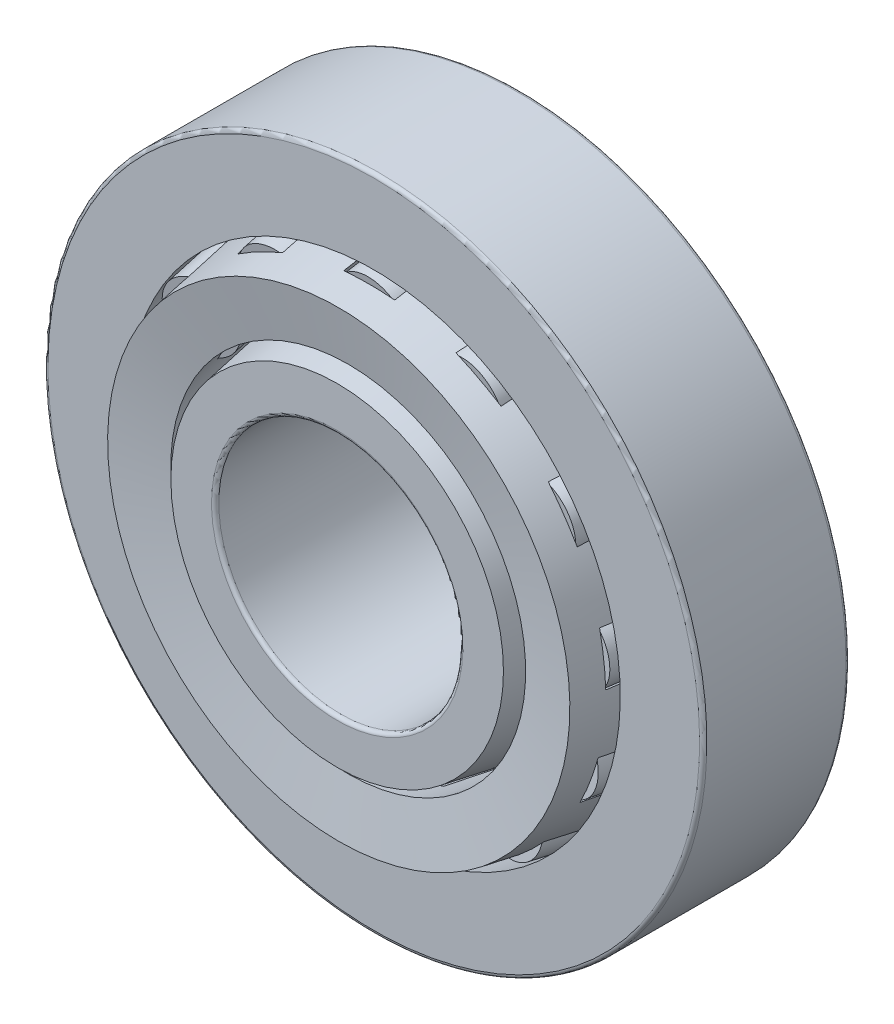
from build123d import *

# Parameters (mm, degrees)
CIRPATTERN2_COUNT = 13
CIRPATTERN1_COUNT = 13
FILLET1_R         = 0.238125
FILLET2_R         = 0.238125


with BuildPart() as part:
    # Sketch1 → Revolve1 (revolve)
    with BuildSketch(Plane(origin=(0, 0, 0), x_dir=(0, 0, -1), z_dir=(1, 0, 0))):
        Polygon((-4.7625, 21.43125), (4.7625, 21.43125), (4.7625, 17.713264491), (-4.7625, 16.03375), align=None)
    revolve(axis=Axis((0, 0, 7.14375), (0, 0, -1)))

    # Fillet1
    fillet1_edges = [part.edges().sort_by_distance(p)[0] for p in [
        (0, -21.43125, -4.7625),
        (0, -21.43125, 4.7625),
    ]]
    fillet(fillet1_edges, radius=FILLET1_R)


with BuildPart() as body_2:
    # Sketch5 → Revolve4 (revolve)
    with BuildSketch(Plane(origin=(0, 0, 0), x_dir=(0, 0, -1), z_dir=(1, 0, 0))):
        Polygon((7.14375, 13.335), (-7.14375, 10.815728263), (-7.14375, 7.9375), (7.14375, 7.9375), align=None)
    revolve(axis=Axis((0, 0, 7.14375), (0, 0, -1)))

    # Fillet2
    fillet2_edges = [body_2.edges().sort_by_distance(p)[0] for p in [
        (0, -7.9375, -7.14375),
        (0, -7.9375, 7.14375),
    ]]
    fillet(fillet2_edges, radius=FILLET2_R)


with BuildPart() as body_3:
    # Sketch2 → Revolve2 (revolve)
    with BuildSketch(Plane(origin=(0, 0, 0), x_dir=(0, 0, -1), z_dir=(1, 0, 0))):
        Polygon((-7.04118365, 15.032188703), (-6.425785552, 11.542092656), (4.7625, 13.514889266), (6.53318365, 13.827108568), (5.917785552, 17.317204615), (4.7625, 17.113496602), align=None)
    revolve(axis=Axis((0, 0, 7.14375), (0, 0, -1)))

    # Sketch3 → Cut-Revolve1 (revolve, cut)
    with BuildSketch(Plane(origin=(0, 0, 0), x_dir=(0, 0, -1), z_dir=(1, 0, 0))):
        Polygon((-4.7625, 13.634678443), (-5.172765399, 15.961409141), (4.352234601, 17.640923632), (4.7625, 15.314192934), align=None)
    cut_revolve1 = revolve(axis=Axis((0, 13.287140679, 6.733484601), (0, 0.17364817766692697, -0.9848077530122087)), mode=Mode.SUBTRACT)

    # CirPattern1: Cut-Revolve1 ×13 about axis
    cirpattern1_axis = Axis((0, 0, -7.14375), (0, 0, 1))
    for i in range(1, CIRPATTERN1_COUNT):
        add(cut_revolve1.rotate(cirpattern1_axis, i * 360 / CIRPATTERN1_COUNT), mode=Mode.SUBTRACT)


with BuildPart() as body_4:
    # Sketch4 → Revolve3 (revolve)
    with BuildSketch(Plane(origin=(0, 0, 0), x_dir=(0, 0, -1), z_dir=(1, 0, 0))):
        Polygon((-5.15071208, 15.836338556), (4.37428792, 17.515853048), (4.7625, 15.314192934), (-4.7625, 13.634678443), align=None)
    revolve(axis=Axis((0, 13.287140679, 6.733484601), (0, 0.17364817766692697, -0.9848077530122087)))


with BuildPart() as cirpattern2_1:
    # CirPattern2: pattern copy
    add(body_4.part.rotate(Axis((0, 0, -7.14375), (0, 0, 1)), 1 * 360 / CIRPATTERN2_COUNT))


with BuildPart() as cirpattern2_2:
    # CirPattern2: pattern copy
    add(body_4.part.rotate(Axis((0, 0, -7.14375), (0, 0, 1)), 2 * 360 / CIRPATTERN2_COUNT))


with BuildPart() as cirpattern2_3:
    # CirPattern2: pattern copy
    add(body_4.part.rotate(Axis((0, 0, -7.14375), (0, 0, 1)), 3 * 360 / CIRPATTERN2_COUNT))


with BuildPart() as cirpattern2_4:
    # CirPattern2: pattern copy
    add(body_4.part.rotate(Axis((0, 0, -7.14375), (0, 0, 1)), 4 * 360 / CIRPATTERN2_COUNT))


with BuildPart() as cirpattern2_5:
    # CirPattern2: pattern copy
    add(body_4.part.rotate(Axis((0, 0, -7.14375), (0, 0, 1)), 5 * 360 / CIRPATTERN2_COUNT))


with BuildPart() as cirpattern2_6:
    # CirPattern2: pattern copy
    add(body_4.part.rotate(Axis((0, 0, -7.14375), (0, 0, 1)), 6 * 360 / CIRPATTERN2_COUNT))


with BuildPart() as cirpattern2_7:
    # CirPattern2: pattern copy
    add(body_4.part.rotate(Axis((0, 0, -7.14375), (0, 0, 1)), 7 * 360 / CIRPATTERN2_COUNT))


with BuildPart() as cirpattern2_8:
    # CirPattern2: pattern copy
    add(body_4.part.rotate(Axis((0, 0, -7.14375), (0, 0, 1)), 8 * 360 / CIRPATTERN2_COUNT))


with BuildPart() as cirpattern2_9:
    # CirPattern2: pattern copy
    add(body_4.part.rotate(Axis((0, 0, -7.14375), (0, 0, 1)), 9 * 360 / CIRPATTERN2_COUNT))


with BuildPart() as cirpattern2_10:
    # CirPattern2: pattern copy
    add(body_4.part.rotate(Axis((0, 0, -7.14375), (0, 0, 1)), 10 * 360 / CIRPATTERN2_COUNT))


with BuildPart() as cirpattern2_11:
    # CirPattern2: pattern copy
    add(body_4.part.rotate(Axis((0, 0, -7.14375), (0, 0, 1)), 11 * 360 / CIRPATTERN2_COUNT))


with BuildPart() as cirpattern2_12:
    # CirPattern2: pattern copy
    add(body_4.part.rotate(Axis((0, 0, -7.14375), (0, 0, 1)), 12 * 360 / CIRPATTERN2_COUNT))


solid = Compound([part.part, body_2.part, body_3.part, body_4.part, cirpattern2_1.part, cirpattern2_2.part, cirpattern2_3.part, cirpattern2_4.part, cirpattern2_5.part, cirpattern2_6.part, cirpattern2_7.part, cirpattern2_8.part, cirpattern2_9.part, cirpattern2_10.part, cirpattern2_11.part, cirpattern2_12.part])
